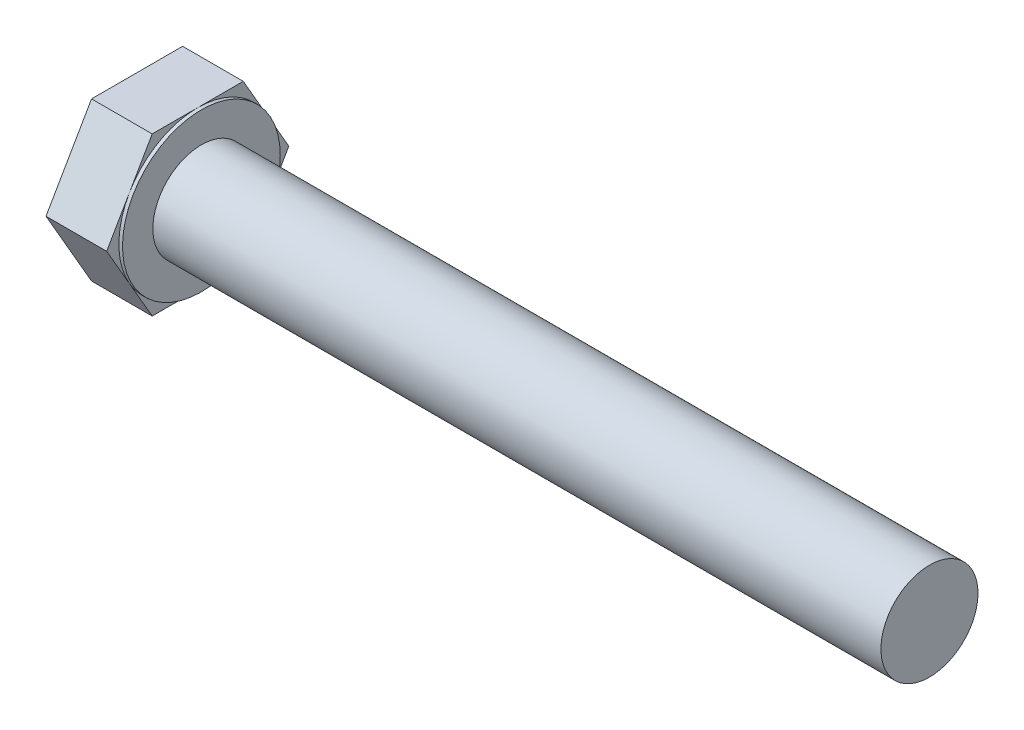
from build123d import *

# Parameters (mm, degrees)
BOSS_EXTRUDE1_DEPTH = 5
SKETCH2_R           = 6.5
BOSS_EXTRUDE2_DEPTH = 0.3
SKETCH3_R           = 4
BOSS_EXTRUDE3_DEPTH = 60


with BuildPart() as part:
    # Sketch1 → Boss-Extrude1 (new body)
    with BuildSketch(Plane(origin=(0, 0, 0), x_dir=(0, 0, -1), z_dir=(1, 0, 0))):
        Polygon((-7.505553499, 0), (-3.75277675, -6.5), (3.75277675, -6.5), (7.505553499, 0), (3.75277675, 6.5), (-3.75277675, 6.5), align=None)
    extrude(amount=-BOSS_EXTRUDE1_DEPTH)

    # Sketch2 → Boss-Extrude2 (add)
    with BuildSketch(Plane(origin=(0, 0, 0), x_dir=(0, 0, -1), z_dir=(1, 0, 0))):
        with Locations(Location((0, 0, 0), (0, 0, 150))):
            Circle(SKETCH2_R)
    extrude(amount=BOSS_EXTRUDE2_DEPTH)

    # Sketch3 → Boss-Extrude3 (add)
    with BuildSketch(Plane(origin=(0.3, 0, 0), x_dir=(0, 0, -1), z_dir=(1, 0, 0))):
        Circle(SKETCH3_R)
    extrude(amount=BOSS_EXTRUDE3_DEPTH)


solid = part.part
